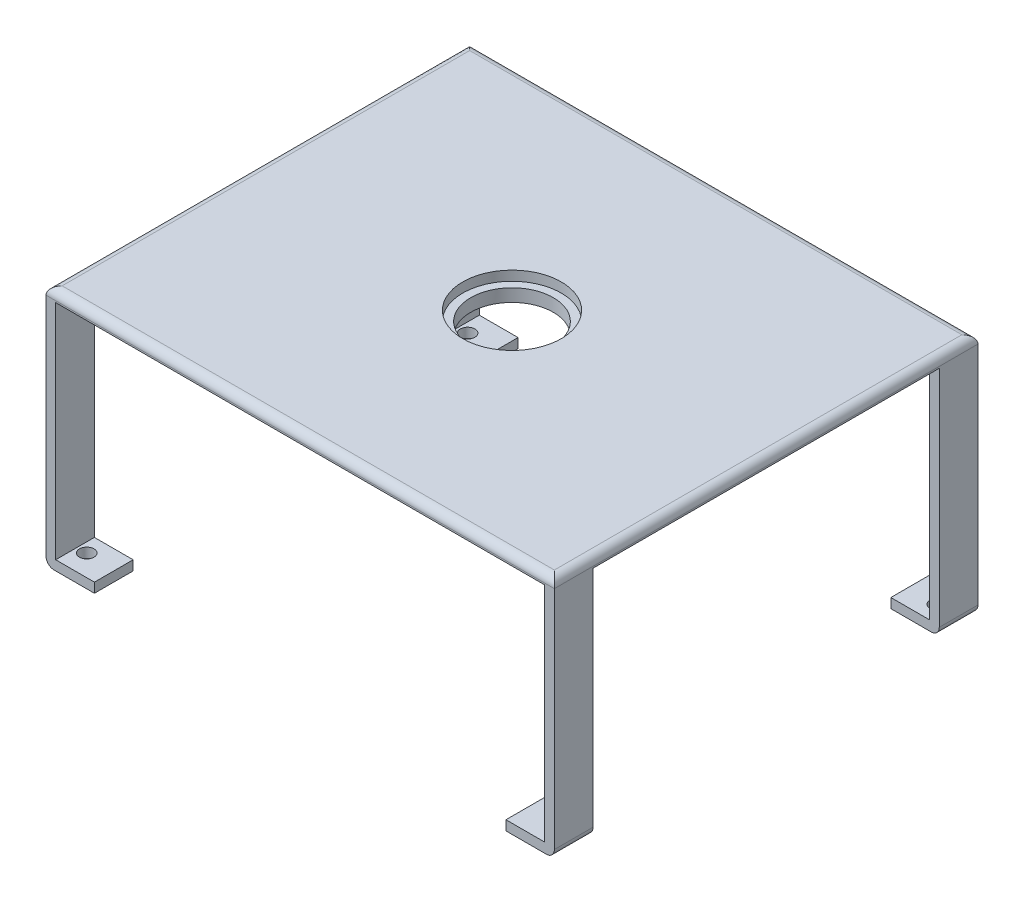
from build123d import *

# Parameters (mm, degrees)
BOSS_EXTRU_1_DEPTH      = 133.35
ESQUISSE3_W             = 108.966
ESQUISSE3_H             = 73.152
ENL_V_MAT_EXTRU_1_DEPTH = 222.799600766
ESQUISSE4_R             = 2.286
ENL_V_MAT_EXTRU_2_DEPTH = 172.857608804
CONG_1_R                = 2.54
CONG_2_R                = 2.54
ESQUISSE5_R             = 2.286
ENL_V_MAT_EXTRU_3_DEPTH = 172.857608804
ESQUISSE6_R             = 15.5
ENL_V_MAT_EXTRU_4_DEPTH = 174.176969023
SKETCH1_R               = 17.5
BOSS_EXTRUDE1_DEPTH     = 4
SKETCH2_R               = 13
CUT_EXTRUDE1_DEPTH      = 172.857608804


with BuildPart() as part:
    # Esquisse2 → Boss.-Extru.1 (new body)
    with BuildSketch(Plane.XY):
        Polygon((-64.77, 0), (-80.01, 0), (-80.01, 76.2), (80.01, 76.2), (80.01, 0), (64.77, 0), (64.77, 3.048), (76.962, 3.048), (76.962, 73.152), (-76.962, 73.152), (-76.962, 3.048), (-64.77, 3.048), align=None)
    extrude(amount=BOSS_EXTRU_1_DEPTH)

    # Esquisse3 → Enlèv. mat.-Extru.1 (cut, through all)
    with BuildSketch(Plane.ZY.offset(80.01)):
        with Locations((66.675, 36.576)):
            Rectangle(ESQUISSE3_W, ESQUISSE3_H)
    extrude(amount=-ENL_V_MAT_EXTRU_1_DEPTH, mode=Mode.SUBTRACT)

    # Esquisse4 → Enlèv. mat.-Extru.2 (cut, through all)
    with BuildSketch(Plane(origin=(0, 3.048, 0), x_dir=(1, 0, 0), z_dir=(0, 1, 0))):
        with Locations(Location((73.914, -6.731, 0), (0, 0, 180))):
            Circle(ESQUISSE4_R)
    enl_v_mat_extru_2 = extrude(amount=-ENL_V_MAT_EXTRU_2_DEPTH, mode=Mode.SUBTRACT)

    # Congé1
    cong_1_edges = [part.edges().sort_by_distance(p)[0] for p in [
        (-80.01, 0, 127.254),
        (80.01, 0, 127.254),
        (-80.01, 0, 6.096),
        (80.01, 0, 6.096),
    ]]
    fillet(cong_1_edges, radius=CONG_1_R)

    # Congé2
    cong_2_edges = [part.edges().sort_by_distance(p)[0] for p in [
        (0, 76.2, 0),
        (-80.01, 76.2, 66.675),
        (80.01, 76.2, 66.675),
        (0, 76.2, 133.35),
    ]]
    fillet(cong_2_edges, radius=CONG_2_R)

    # Esquisse5 → Enlèv. mat.-Extru.3 (cut, through all)
    with BuildSketch(Plane(origin=(0, 3.048, 0), x_dir=(1, 0, 0), z_dir=(0, 1, 0))):
        with Locations(Location((73.914, -126.619, 0), (0, 0, 180))):
            Circle(ESQUISSE5_R)
    enl_v_mat_extru_3 = extrude(amount=-ENL_V_MAT_EXTRU_3_DEPTH, mode=Mode.SUBTRACT)

    # Esquisse6 → Enlèv. mat.-Extru.4 (cut, through all)
    with BuildSketch(Plane(origin=(0, 76.2, 0), x_dir=(1, 0, 0), z_dir=(0, 1, 0))):
        with Locations(Location((0, -66.675, 0), (0, 0, 270))):
            Circle(ESQUISSE6_R)
    extrude(amount=-ENL_V_MAT_EXTRU_4_DEPTH, mode=Mode.SUBTRACT)

    # Symétrie1: Enlèv. mat.-Extru.3 across plane
    add(enl_v_mat_extru_3.mirror(Plane(origin=(0, 0, 0), x_dir=(0, 0, 1), z_dir=(1, 0, 0))), mode=Mode.SUBTRACT)

    # Symétrie2: Enlèv. mat.-Extru.2 across plane
    add(enl_v_mat_extru_2.mirror(Plane(origin=(0, 0, 0), x_dir=(0, 0, 1), z_dir=(1, 0, 0))), mode=Mode.SUBTRACT)

    # Sketch1 → Boss-Extrude1 (add)
    with BuildSketch(Plane.XZ.offset(-73.152)):
        with Locations(Location((0, 66.675, 0), (0, 0, 90))):
            Circle(SKETCH1_R)
    extrude(amount=BOSS_EXTRUDE1_DEPTH)

    # Sketch2 → Cut-Extrude1 (cut, through all)
    with BuildSketch(Plane(origin=(0, 73.152, 0), x_dir=(1, 0, 0), z_dir=(0, 1, 0))):
        with Locations(Location((0, -66.675, 0), (0, 0, 270))):
            Circle(SKETCH2_R)
    extrude(amount=-CUT_EXTRUDE1_DEPTH, mode=Mode.SUBTRACT)


solid = part.part
